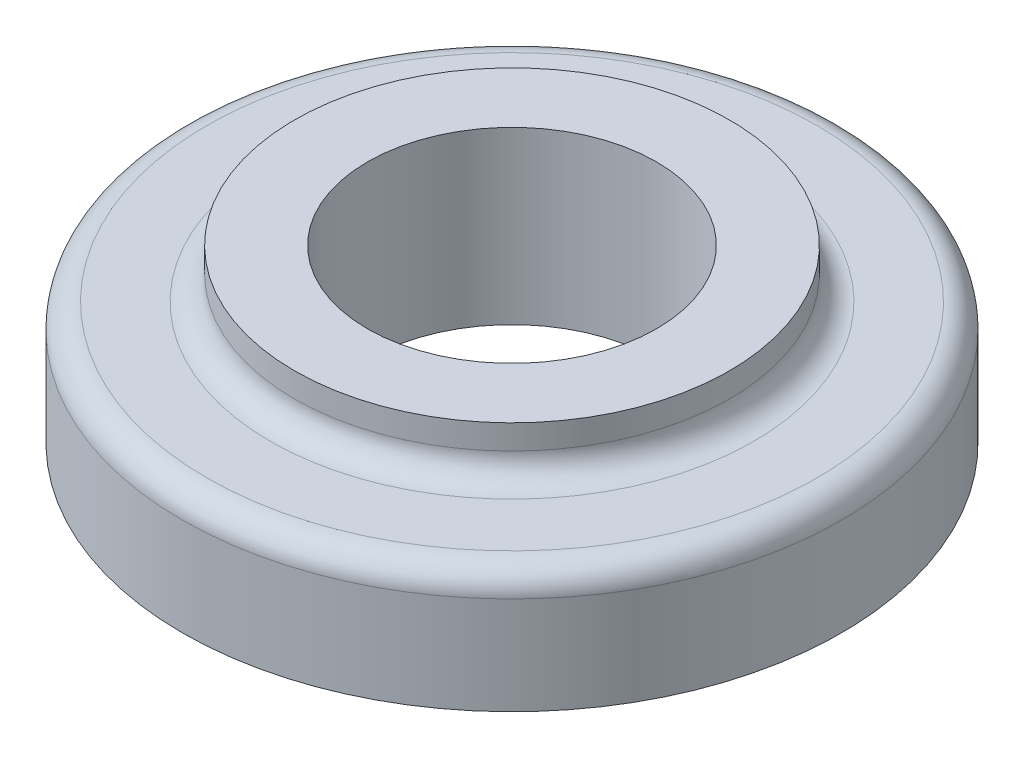
from build123d import *

# Parameters (mm, degrees)
SKETCH1_R           = 27.001022249
BOSS_EXTRUDE1_DEPTH = 10
SKETCH2_R           = 17.811284506
BOSS_EXTRUDE3_DEPTH = 4
SKETCH3_R           = 11.844355023
CUT_EXTRUDE2_DEPTH  = 41.67075614
FILLET1_R           = 2


with BuildPart() as part:
    # Sketch1 → Boss-Extrude1 (new body)
    with BuildSketch(Plane(origin=(0, 0, 0), x_dir=(1, 0, 0), z_dir=(0, 1, 0))):
        with Locations(Location((0, 0, 0), (0, 0, 270))):
            Circle(SKETCH1_R)
    extrude(amount=BOSS_EXTRUDE1_DEPTH)

    # Sketch2 → Boss-Extrude3 (add)
    with BuildSketch(Plane(origin=(0, 10, 0), x_dir=(1, 0, 0), z_dir=(0, 1, 0))):
        with Locations(Location((0, 0, 0), (0, 0, 270))):
            Circle(SKETCH2_R)
    extrude(amount=BOSS_EXTRUDE3_DEPTH)

    # Sketch3 → Cut-Extrude2 (cut, through all)
    with BuildSketch(Plane(origin=(0, 14, 0), x_dir=(1, 0, 0), z_dir=(0, 1, 0))):
        with Locations(Location((0, 0, 0), (0, 0, 270))):
            Circle(SKETCH3_R)
    extrude(amount=-CUT_EXTRUDE2_DEPTH, mode=Mode.SUBTRACT)

    # Fillet1
    fillet1_edges = [part.edges().sort_by_distance(p)[0] for p in [
        (0, 10, -27.001022249),
        (0, 10, -17.811284506),
    ]]
    fillet(fillet1_edges, radius=FILLET1_R)


solid = part.part
